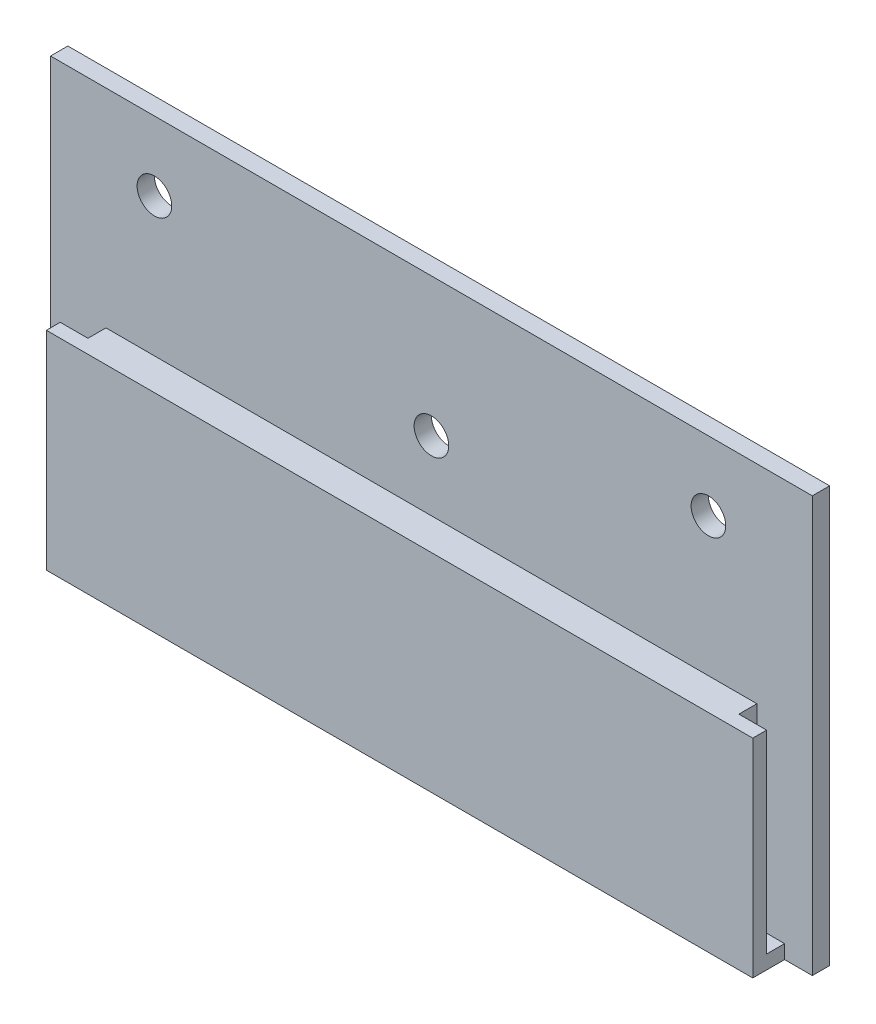
from build123d import *

# Parameters (mm, degrees)
SKETCH3_W               = 139.7
SKETCH3_H               = 76.2
BOSS_EXTRUDE1_DEPTH     = 3.175
SKETCH4_W               = 119.38
SKETCH4_H               = 38.1
BOSS_EXTRUDE2_DEPTH     = 3.302
SKETCH6_W               = 129.54
SKETCH6_H               = 38.1
BOSS_EXTRUDE3_DEPTH     = 2.54
SKETCH7_W               = 129.54
SKETCH7_H               = 9.017
BOSS_EXTRUDE4_DEPTH     = 2.54
CUT_EXTRUDE1_DEPTH      = 160.237743528
CUT_EXTRUDE1_DEPTH_BACK = 160.237743528
SKETCH8_R               = 3.175


with BuildPart() as part:
    # Sketch3 → Boss-Extrude1 (new body)
    with BuildSketch(Plane.XY):
        with Locations((69.85, -38.1)):
            Rectangle(SKETCH3_W, SKETCH3_H)
    extrude(amount=BOSS_EXTRUDE1_DEPTH)

    # Sketch4 → Boss-Extrude2 (add)
    with BuildSketch(Plane.XY.offset(3.175)):
        with Locations((69.85, -57.15)):
            Rectangle(SKETCH4_W, SKETCH4_H)
    extrude(amount=BOSS_EXTRUDE2_DEPTH)

    # Sketch6 → Boss-Extrude3 (add)
    with BuildSketch(Plane.XY.offset(6.477)):
        with Locations((69.85, -57.15)):
            Rectangle(SKETCH6_W, SKETCH6_H)
    extrude(amount=BOSS_EXTRUDE3_DEPTH)

    # Sketch7 → Boss-Extrude4 (add)
    with BuildSketch(Plane.XZ.offset(76.2)):
        with Locations((69.85, 4.5085)):
            Rectangle(SKETCH7_W, SKETCH7_H)
    extrude(amount=-BOSS_EXTRUDE4_DEPTH)

    # Sketch8 → Cut-Extrude1 (cut, two sides: drawn at the far end of the back side and taken through both)
    with BuildSketch(Plane.XY.offset(3.175).offset(-CUT_EXTRUDE1_DEPTH_BACK)):
        with Locations((19.05, -12.7)):
            Circle(SKETCH8_R)
        with Locations((69.85, -25.4)):
            Circle(SKETCH8_R)
        with Locations((120.65, -12.7)):
            Circle(SKETCH8_R)
    extrude(amount=CUT_EXTRUDE1_DEPTH + CUT_EXTRUDE1_DEPTH_BACK, mode=Mode.SUBTRACT)


solid = part.part
